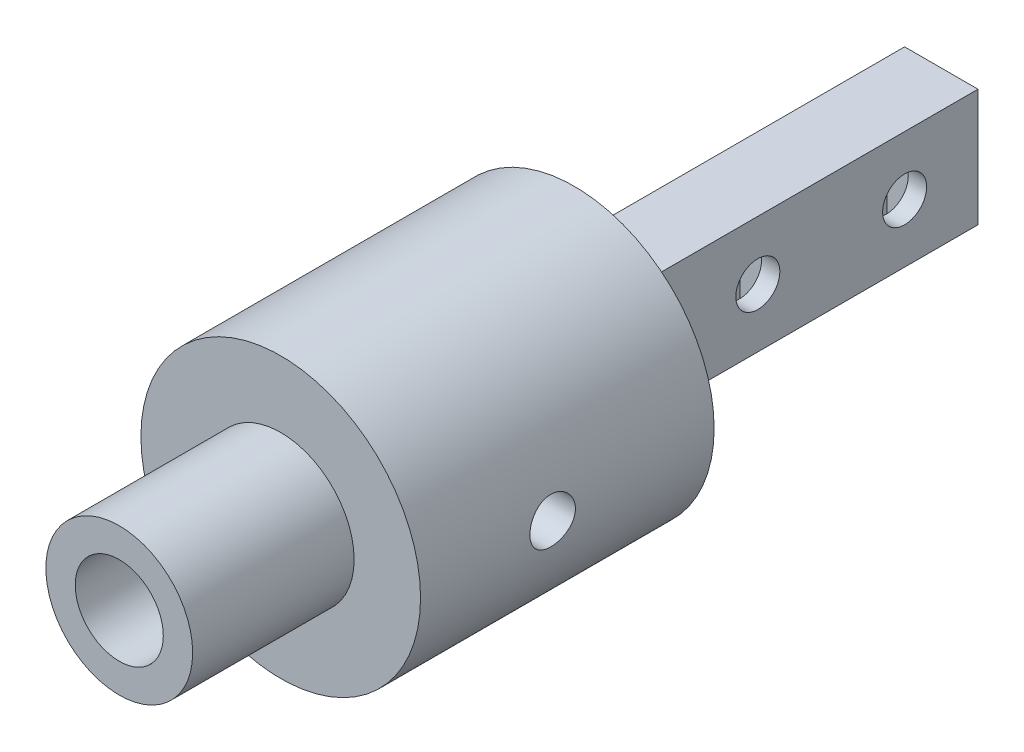
from build123d import *

# Parameters (mm, degrees)
SKETCH2_W                  = 5
SKETCH2_H                  = 8
BOSS_EXTRUDE1_DEPTH        = 25
M2_5_CLEARANCE_HOLE1_D     = 3
M2_5_CLEARANCE_HOLE1_DEPTH = 9.098709071
M2_5_CLEARANCE_HOLE1_TIP   = 0.901290929
SKETCH5_W                  = 2.5
SKETCH5_H                  = 5.1
CUT_EXTRUDE1_DEPTH         = 7.2
M2_5_CLEARANCE_HOLE2_D     = 3.1
SKETCH7_2_R                = 0.5
CUT_EXTRUDE2_DEPTH         = 2.5


with BuildPart() as part:
    # Sketch1 → Revolve1 (revolve)
    with BuildSketch(Plane(origin=(0, 0, 0), x_dir=(1, 0, 0), z_dir=(0, 1, 0)), mode=Mode.PRIVATE) as revolve1_sk:
        Polygon((0, 4), (-5, 4), (-9.525, 4), (-9.525, -16), (-5, -16), (-5, -27), (-3, -27), (-3, 0), (0, 0), align=None)
    revolve(revolve1_sk.sketch.rotate(Axis((0, 0, 0), (0, 0, -1)), 180), axis=Axis((0, 0, 0), (0, 0, -1)))

    # Sketch2 → Boss-Extrude1 (add)
    with BuildSketch(Plane(origin=(0, 0, -4), x_dir=(-1, 0, 0), z_dir=(0, 0, -1))):
        Rectangle(SKETCH2_W, SKETCH2_H)
    extrude(amount=BOSS_EXTRUDE1_DEPTH)

    # M2.5 Clearance Hole1
    with Locations(Plane(origin=(2.5, 0, 0), x_dir=(0, 0, -1), z_dir=(1, 0, 0))):
        with Locations((24, 0), (14, 0)):
            Hole(M2_5_CLEARANCE_HOLE1_D / 2, depth=M2_5_CLEARANCE_HOLE1_DEPTH)
            with Locations((0, 0, -(M2_5_CLEARANCE_HOLE1_DEPTH + M2_5_CLEARANCE_HOLE1_TIP / 2))):  # 118° drill point
                Cone(0, M2_5_CLEARANCE_HOLE1_D / 2, M2_5_CLEARANCE_HOLE1_TIP, mode=Mode.SUBTRACT)

    # Sketch5 → Cut-Extrude1 (cut)
    with BuildSketch(Plane.XZ.offset(4)):
        with Locations((0, -14)):
            Rectangle(SKETCH5_W, SKETCH5_H)
        with Locations((0, -24)):
            Rectangle(SKETCH5_W, SKETCH5_H)
    extrude(amount=-CUT_EXTRUDE1_DEPTH, mode=Mode.SUBTRACT)

    # M2.5 Clearance Hole2 (through all)
    with Locations(Plane.ZY.offset(9.525)):
        with Locations((7, 0)):
            Hole(M2_5_CLEARANCE_HOLE2_D / 2)

    # Sketch7<2> → Cut-Extrude2 (cut)
    with BuildSketch(Plane.ZY.offset(9.525)):
        Polygon((7, -2.944486373), (9.55, -1.472243186), (9.55, 1.472243186), (7, 2.944486373), (4.45, 1.472243186), (4.45, -1.472243186), align=None)
        with Locations((7, 0)):
            Circle(SKETCH7_2_R, mode=Mode.SUBTRACT)
    extrude(amount=-CUT_EXTRUDE2_DEPTH, mode=Mode.SUBTRACT)


solid = part.part
